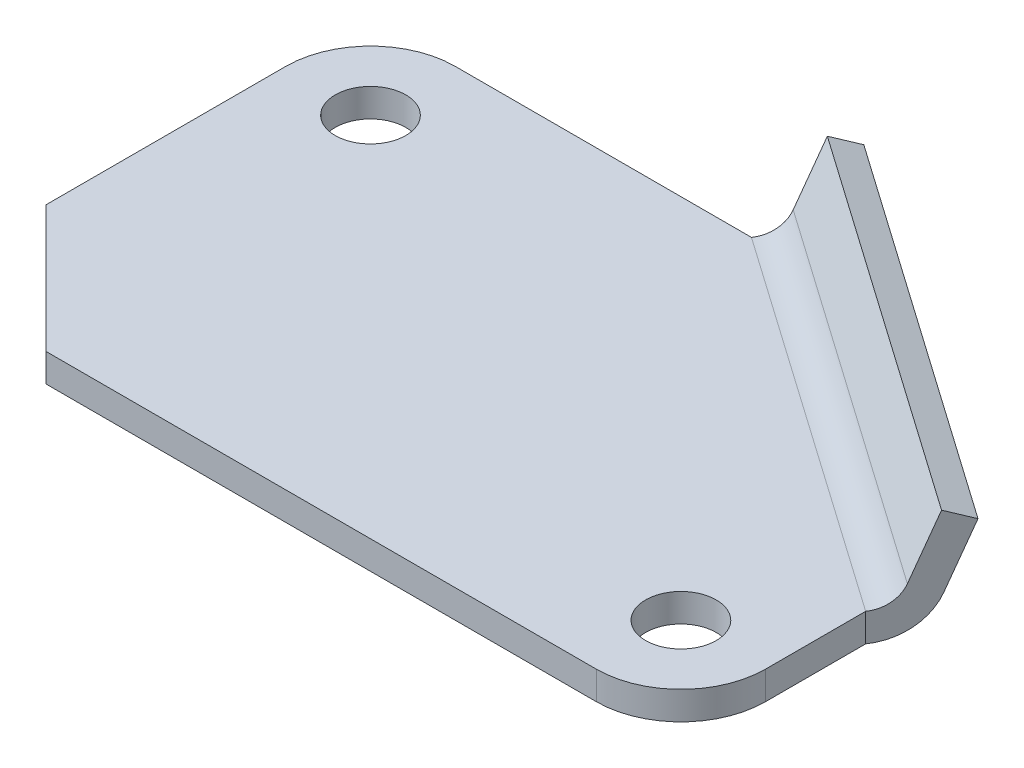
from build123d import *

# Parameters (mm, degrees)
SKETCH2_R           = 5
BOSS_EXTRUDE2_DEPTH = 4
BOSS_EXTRUDE3_DEPTH = 65.921828


with BuildPart() as part:
    # Sketch2 → Boss-Extrude2 (new body)
    with BuildSketch(Plane(origin=(0, 0, 0), x_dir=(1, 0, 0), z_dir=(0, 1, 0))):
        with BuildLine():
            Line((0, 18), (18, 0))
            Line((18, 0), (96, 0))
            ThreePointArc((96, 0), (104.485281374, 3.514718626), (108, 12))
            Line((108, 12), (108, 26.188792937))
            Line((108, 26.188792937), (54, 64))
            Line((54, 64), (12, 64))
            ThreePointArc((12, 64), (3.514718626, 60.485281374), (0, 52))
            Line((0, 52), (0, 18))
        make_face()
        with Locations(Location((12, 52, 0), (0, 0, 270))):
            Circle(SKETCH2_R, mode=Mode.SUBTRACT)
        with Locations(Location((96, 12, 0), (0, 0, 270))):
            Circle(SKETCH2_R, mode=Mode.SUBTRACT)
    extrude(amount=BOSS_EXTRUDE2_DEPTH)

    # Sketch6 → Boss-Extrude3 (add)
    with BuildSketch(Plane(origin=(6.164380005, 0, 4.316345348), x_dir=(0.5735764363510455, 0, -0.8191520442889922), z_dir=(0.8191520442889922, 0, 0.5735764363510455))):
        with BuildLine():
            Line((91.356422356, 5.367444663), (94.832896583, 13.972020318))
            Line((94.832896583, 13.972020318), (91.124161165, 15.470446692))
            Line((91.124161165, 15.470446692), (87.647686938, 6.865871037))
            ThreePointArc((87.647686938, 6.865871037), (85.96136502, 4.783436896), (83.398858397, 4))
            Line((83.398858397, 4), (83.398858397, 0))
            ThreePointArc((83.398858397, 0), (88.198136634, 1.467286606), (91.356422356, 5.367444663))
        make_face()
    extrude(amount=BOSS_EXTRUDE3_DEPTH)


solid = part.part
